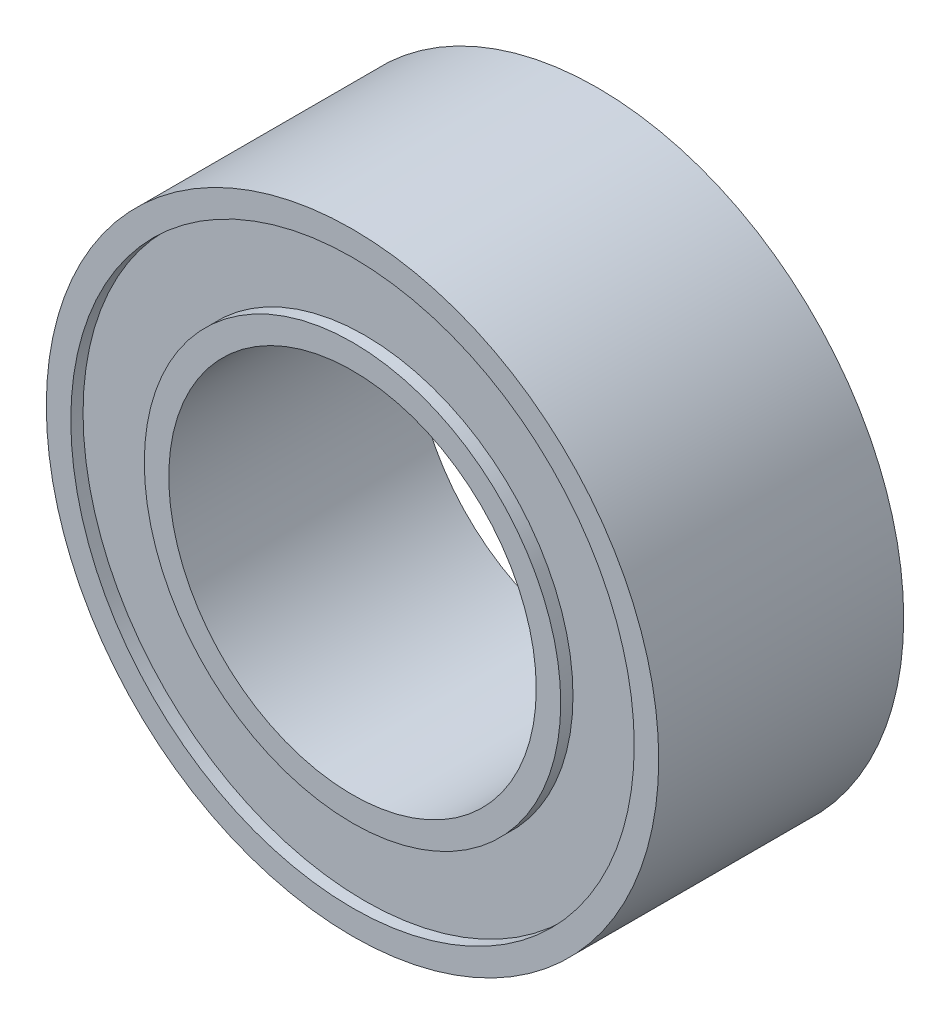
from build123d import *

# Parameters (mm, degrees)
SKETCH1_R           = 25
SKETCH1_R_2         = 15
BOSS_EXTRUDE1_DEPTH = 20
SKETCH2_R           = 23
SKETCH2_R_2         = 17
CUT_EXTRUDE1_DEPTH  = 1
CUT_EXTRUDE2_START  = -1
SKETCH3_R           = 23
SKETCH3_R_2         = 17
CUT_EXTRUDE2_DEPTH  = 1


with BuildPart() as part:
    # Sketch1 → Boss-Extrude1 (new body)
    with BuildSketch(Plane.XY):
        Circle(SKETCH1_R)
        Circle(SKETCH1_R_2, mode=Mode.SUBTRACT)
    extrude(amount=BOSS_EXTRUDE1_DEPTH)

    # Sketch2 → Cut-Extrude1 (cut)
    with BuildSketch(Plane.XY.offset(20)):
        Circle(SKETCH2_R)
        Circle(SKETCH2_R_2, mode=Mode.SUBTRACT)
    extrude(amount=-CUT_EXTRUDE1_DEPTH, mode=Mode.SUBTRACT)

    # Sketch3 → Cut-Extrude2 (cut)
    with BuildSketch(Plane(origin=(0, 0, 0), x_dir=(-1, 0, 0), z_dir=(0, 0, -1)).offset(CUT_EXTRUDE2_START)):
        with Locations(Location((0, 0, 0), (0, 0, 180))):
            Circle(SKETCH3_R)
        with Locations(Location((0, 0, 0), (0, 0, 180))):
            Circle(SKETCH3_R_2, mode=Mode.SUBTRACT)
    extrude(amount=CUT_EXTRUDE2_DEPTH, mode=Mode.SUBTRACT)


solid = part.part
